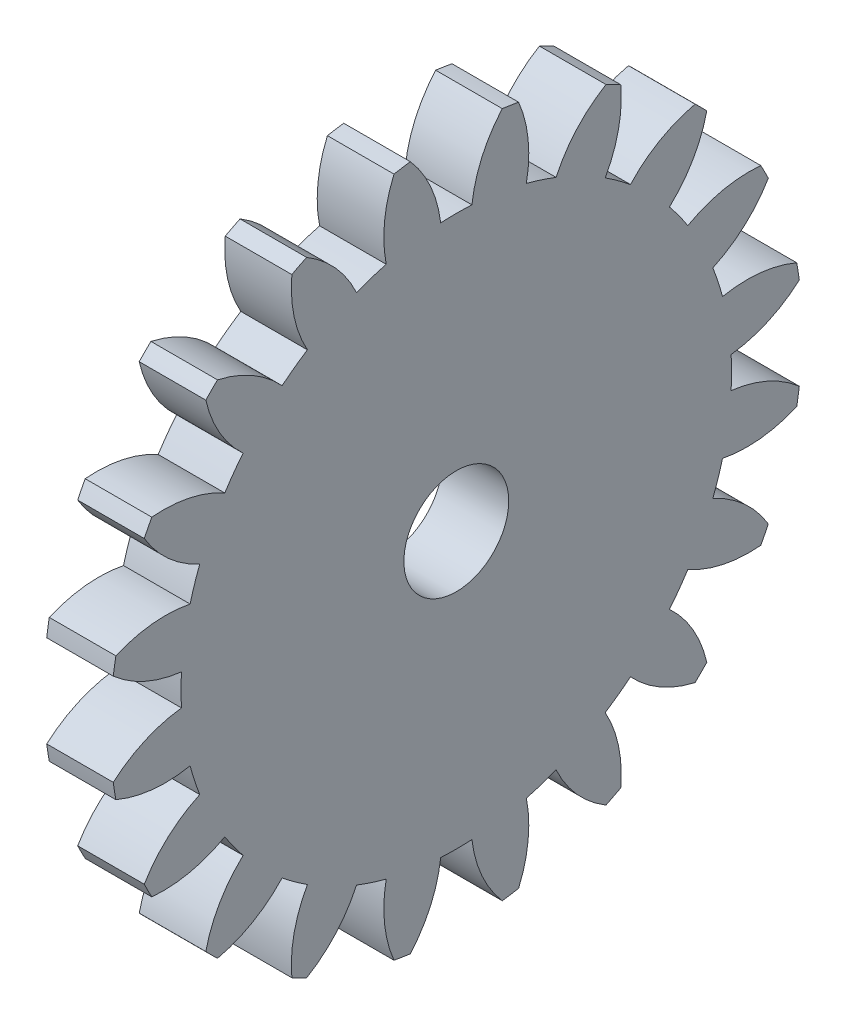
from build123d import *

# Parameters (mm, degrees)
BASPROSKE_W        = 12.7
BASPROSKE_H        = 33
TOOTHCUT_DEPTH     = 49.366207211
TEETHCUTS_COUNT    = 20
TEETHCUTS_ANGLE    = 342
BORSKE_R           = 5
BORE_DEPTH         = 50.0000508
CUT_EXTRUDE1_START = -6.35
CUT_EXTRUDE1_DEPTH = 6.35


with BuildPart() as part:
    # BasProSke → Base-Revolve (revolve)
    with BuildSketch(Plane(origin=(0, 0, 0), x_dir=(1, 0, 0), z_dir=(0, 1, 0)), mode=Mode.PRIVATE) as base_revolve_sk:
        with Locations((6.35, 16.5)):
            Rectangle(BASPROSKE_W, BASPROSKE_H)
    revolve(base_revolve_sk.sketch.rotate(Axis((-10, 0, 0), (1, 0, 0)), 180), axis=Axis((-10, 0, 0), (1, 0, 0)))

    # TooCutSke → ToothCut (cut, through all)
    with BuildSketch(Plane(origin=(0, 0, 0), x_dir=(0, 0, -1), z_dir=(1, 0, 0))):
        with BuildLine():
            ThreePointArc((1.489278925, 26.206717637), (0, 26.249), (-1.489278925, 26.206717637))
            ThreePointArc((-1.489278925, 26.206717637), (-2.448651415, 29.690511169), (-4.401620335, 32.730762038))
            ThreePointArc((-4.401620335, 32.730762038), (0, 33.0254), (4.401620335, 32.730762038))
            ThreePointArc((4.401620335, 32.730762038), (2.448651415, 29.690511169), (1.489278925, 26.206717637))
        make_face()
    toothcut = extrude(amount=TOOTHCUT_DEPTH, mode=Mode.SUBTRACT)

    # TeethCuts: ToothCut ×20 about axis
    teethcuts_axis = Axis((-10, 0, 0), (1, 0, 0))
    for i in range(1, TEETHCUTS_COUNT):
        add(toothcut.rotate(teethcuts_axis, i * TEETHCUTS_ANGLE / (TEETHCUTS_COUNT - 1)), mode=Mode.SUBTRACT)

    # BorSke → Bore (cut, symmetric)
    with BuildSketch(Plane(origin=(0, 0, 0), x_dir=(0, 0, -1), z_dir=(1, 0, 0))):
        with Locations(Location((0, 0, 0), (0, 0, 180))):
            Circle(BORSKE_R)
    extrude(amount=BORE_DEPTH, both=True, mode=Mode.SUBTRACT)

    # Sketch1 → Cut-Extrude1 (cut)
    with BuildSketch(Plane(origin=(12.7, 0, 0), x_dir=(0, 0, -1), z_dir=(1, 0, 0)).offset(CUT_EXTRUDE1_START)):
        with BuildLine():
            ThreePointArc((-32.707837592, 4.381479207), (-29.676574647, 2.442440757), (-26.206717637, 1.489278925))
            ThreePointArc((-26.206717637, 1.489278925), (-26.249, 0), (-26.206717637, -1.489278925))
            ThreePointArc((-26.206717637, -1.489278925), (-29.676574647, -2.442440757), (-32.707837592, -4.381479207))
            ThreePointArc((-32.707837592, -4.381479207), (-32.59371524, -5.162337346), (-32.460953611, -5.940243315))
            ThreePointArc((-32.460953611, -5.940243315), (-28.978855401, -6.847666703), (-25.384282076, -6.68193269))
            ThreePointArc((-25.384282076, -6.68193269), (-24.964282496, -8.111387085), (-24.463857082, -9.514709543))
            ThreePointArc((-24.463857082, -9.514709543), (-27.469343998, -11.493465099), (-29.753050541, -14.274312016))
            ThreePointArc((-29.753050541, -14.274312016), (-29.403215298, -14.981686491), (-29.036565322, -15.680493433))
            ThreePointArc((-29.036565322, -15.680493433), (-25.444483881, -15.467476836), (-22.077056123, -14.199070178))
            ThreePointArc((-22.077056123, -14.199070178), (-21.235887085, -15.428775087), (-20.326303746, -16.608774097))
            ThreePointArc((-20.326303746, -16.608774097), (-22.573222567, -19.419428996), (-23.885827601, -22.76987571))
            ThreePointArc((-23.885827601, -22.76987571), (-23.334523779, -23.334523779), (-22.76987571, -23.885827601))
            ThreePointArc((-22.76987571, -23.885827601), (-19.419428996, -22.573222567), (-16.608774097, -20.326303746))
            ThreePointArc((-16.608774097, -20.326303746), (-15.428775087, -21.235887085), (-14.199070178, -22.077056123))
            ThreePointArc((-14.199070178, -22.077056123), (-15.467476836, -25.444483881), (-15.680493433, -29.036565322))
            ThreePointArc((-15.680493433, -29.036565322), (-14.981686491, -29.403215298), (-14.274312016, -29.753050541))
            ThreePointArc((-14.274312016, -29.753050541), (-11.493465099, -27.469343998), (-9.514709543, -24.463857082))
            ThreePointArc((-9.514709543, -24.463857082), (-8.111387085, -24.964282496), (-6.68193269, -25.384282076))
            ThreePointArc((-6.68193269, -25.384282076), (-6.847666703, -28.978855401), (-5.940243315, -32.460953611))
            ThreePointArc((-5.940243315, -32.460953611), (-5.162337346, -32.59371524), (-4.381479207, -32.707837592))
            ThreePointArc((-4.381479207, -32.707837592), (-2.442440757, -29.676574647), (-1.489278925, -26.206717637))
            ThreePointArc((-1.489278925, -26.206717637), (0, -26.249), (1.489278925, -26.206717637))
            ThreePointArc((1.489278925, -26.206717637), (2.442440757, -29.676574647), (4.381479207, -32.707837592))
            ThreePointArc((4.381479207, -32.707837592), (5.162337346, -32.59371524), (5.940243315, -32.460953611))
            ThreePointArc((5.940243315, -32.460953611), (6.847666703, -28.978855401), (6.68193269, -25.384282076))
            ThreePointArc((6.68193269, -25.384282076), (8.111387085, -24.964282496), (9.514709543, -24.463857082))
            ThreePointArc((9.514709543, -24.463857082), (11.493465099, -27.469343998), (14.274312016, -29.753050541))
            ThreePointArc((14.274312016, -29.753050541), (14.981686491, -29.403215298), (15.680493433, -29.036565322))
            ThreePointArc((15.680493433, -29.036565322), (15.467476836, -25.444483881), (14.199070178, -22.077056123))
            ThreePointArc((14.199070178, -22.077056123), (15.428775087, -21.235887085), (16.608774097, -20.326303746))
            ThreePointArc((16.608774097, -20.326303746), (19.419428996, -22.573222567), (22.76987571, -23.885827601))
            ThreePointArc((22.76987571, -23.885827601), (23.334523779, -23.334523779), (23.885827601, -22.76987571))
            ThreePointArc((23.885827601, -22.76987571), (22.573222567, -19.419428996), (20.326303746, -16.608774097))
            ThreePointArc((20.326303746, -16.608774097), (21.235887085, -15.428775087), (22.077056123, -14.199070178))
            ThreePointArc((22.077056123, -14.199070178), (25.444483881, -15.467476836), (29.036565322, -15.680493433))
            ThreePointArc((29.036565322, -15.680493433), (29.403215298, -14.981686491), (29.753050541, -14.274312016))
            ThreePointArc((29.753050541, -14.274312016), (27.469343998, -11.493465099), (24.463857082, -9.514709543))
            ThreePointArc((24.463857082, -9.514709543), (24.964282496, -8.111387085), (25.384282076, -6.68193269))
            ThreePointArc((25.384282076, -6.68193269), (28.978855401, -6.847666703), (32.460953611, -5.940243315))
            ThreePointArc((32.460953611, -5.940243315), (32.59371524, -5.162337346), (32.707837592, -4.381479207))
            ThreePointArc((32.707837592, -4.381479207), (29.676574647, -2.442440757), (26.206717637, -1.489278925))
            ThreePointArc((26.206717637, -1.489278925), (26.249, 0), (26.206717637, 1.489278925))
            ThreePointArc((26.206717637, 1.489278925), (29.676574647, 2.442440757), (32.707837592, 4.381479207))
            ThreePointArc((32.707837592, 4.381479207), (32.59371524, 5.162337346), (32.460953611, 5.940243315))
            ThreePointArc((32.460953611, 5.940243315), (28.978855401, 6.847666703), (25.384282076, 6.68193269))
            ThreePointArc((25.384282076, 6.68193269), (24.964282496, 8.111387085), (24.463857082, 9.514709543))
            ThreePointArc((24.463857082, 9.514709543), (27.469343998, 11.493465099), (29.753050541, 14.274312016))
            ThreePointArc((29.753050541, 14.274312016), (29.403215298, 14.981686491), (29.036565322, 15.680493433))
            ThreePointArc((29.036565322, 15.680493433), (25.444483881, 15.467476836), (22.077056123, 14.199070178))
            ThreePointArc((22.077056123, 14.199070178), (21.235887085, 15.428775087), (20.326303746, 16.608774097))
            ThreePointArc((20.326303746, 16.608774097), (22.573222567, 19.419428996), (23.885827601, 22.76987571))
            ThreePointArc((23.885827601, 22.76987571), (23.334523779, 23.334523779), (22.76987571, 23.885827601))
            ThreePointArc((22.76987571, 23.885827601), (19.419428996, 22.573222567), (16.608774097, 20.326303746))
            ThreePointArc((16.608774097, 20.326303746), (15.428775087, 21.235887085), (14.199070178, 22.077056123))
            ThreePointArc((14.199070178, 22.077056123), (15.467476836, 25.444483881), (15.680493433, 29.036565322))
            ThreePointArc((15.680493433, 29.036565322), (14.981686491, 29.403215298), (14.274312016, 29.753050541))
            ThreePointArc((14.274312016, 29.753050541), (11.493465099, 27.469343998), (9.514709543, 24.463857082))
            ThreePointArc((9.514709543, 24.463857082), (8.111387085, 24.964282496), (6.68193269, 25.384282076))
            ThreePointArc((6.68193269, 25.384282076), (6.847666703, 28.978855401), (5.940243315, 32.460953611))
            ThreePointArc((5.940243315, 32.460953611), (5.162337346, 32.59371524), (4.381479207, 32.707837592))
            ThreePointArc((4.381479207, 32.707837592), (2.442440757, 29.676574647), (1.489278925, 26.206717637))
            ThreePointArc((1.489278925, 26.206717637), (0, 26.249), (-1.489278925, 26.206717637))
            ThreePointArc((-1.489278925, 26.206717637), (-2.442440757, 29.676574647), (-4.381479207, 32.707837592))
            ThreePointArc((-4.381479207, 32.707837592), (-5.162337346, 32.59371524), (-5.940243315, 32.460953611))
            ThreePointArc((-5.940243315, 32.460953611), (-6.847666703, 28.978855401), (-6.68193269, 25.384282076))
            ThreePointArc((-6.68193269, 25.384282076), (-8.111387085, 24.964282496), (-9.514709543, 24.463857082))
            ThreePointArc((-9.514709543, 24.463857082), (-11.493465099, 27.469343998), (-14.274312016, 29.753050541))
            ThreePointArc((-14.274312016, 29.753050541), (-14.981686491, 29.403215298), (-15.680493433, 29.036565322))
            ThreePointArc((-15.680493433, 29.036565322), (-15.467476836, 25.444483881), (-14.199070178, 22.077056123))
            ThreePointArc((-14.199070178, 22.077056123), (-15.428775087, 21.235887085), (-16.608774097, 20.326303746))
            ThreePointArc((-16.608774097, 20.326303746), (-19.419428996, 22.573222567), (-22.76987571, 23.885827601))
            ThreePointArc((-22.76987571, 23.885827601), (-23.334523779, 23.334523779), (-23.885827601, 22.76987571))
            ThreePointArc((-23.885827601, 22.76987571), (-22.573222567, 19.419428996), (-20.326303746, 16.608774097))
            ThreePointArc((-20.326303746, 16.608774097), (-21.235887085, 15.428775087), (-22.077056123, 14.199070178))
            ThreePointArc((-22.077056123, 14.199070178), (-25.444483881, 15.467476836), (-29.036565322, 15.680493433))
            ThreePointArc((-29.036565322, 15.680493433), (-29.403215298, 14.981686491), (-29.753050541, 14.274312016))
            ThreePointArc((-29.753050541, 14.274312016), (-27.469343998, 11.493465099), (-24.463857082, 9.514709543))
            ThreePointArc((-24.463857082, 9.514709543), (-24.964282496, 8.111387085), (-25.384282076, 6.68193269))
            ThreePointArc((-25.384282076, 6.68193269), (-28.978855401, 6.847666703), (-32.460953611, 5.940243315))
            ThreePointArc((-32.460953611, 5.940243315), (-32.59371524, 5.162337346), (-32.707837592, 4.381479207))
        make_face()
    extrude(amount=CUT_EXTRUDE1_DEPTH, mode=Mode.SUBTRACT)


solid = part.part
